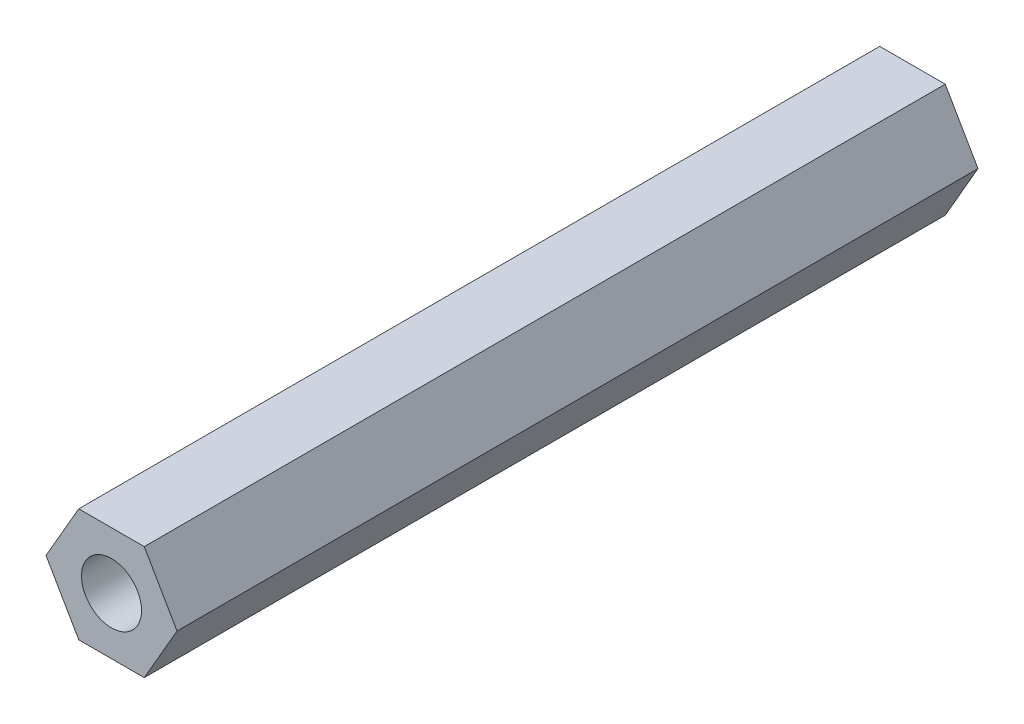
from build123d import *

# Parameters (mm, degrees)
CROQUIS1_R              = 2.25
SALIENTE_EXTRUIR1_DEPTH = 60


with BuildPart() as part:
    # Croquis1 → Saliente-Extruir1 (new body)
    with BuildSketch(Plane.XY):
        Polygon((4.907477288, 0), (2.453738644, 4.25), (-2.453738644, 4.25), (-4.907477288, 0), (-2.453738644, -4.25), (2.453738644, -4.25), align=None)
        Circle(CROQUIS1_R, mode=Mode.SUBTRACT)
    extrude(amount=SALIENTE_EXTRUIR1_DEPTH)


solid = part.part
